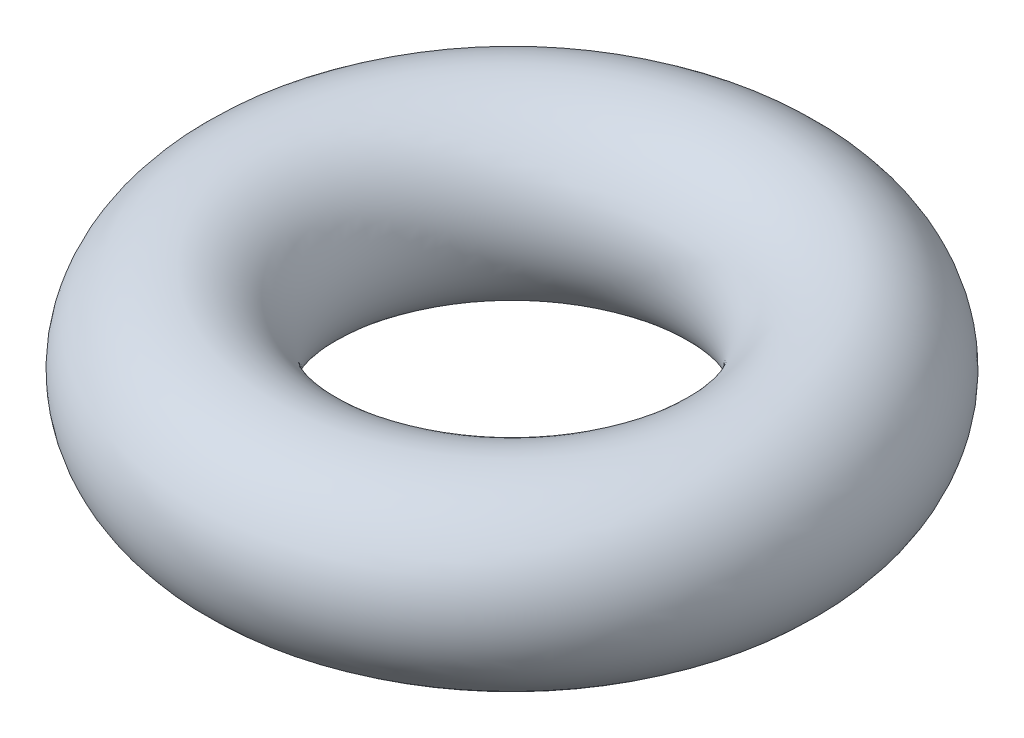
from build123d import *

# Parameters (mm, degrees)
SKETCH_1_R = 15


with BuildPart() as part:
    # 草图1 → 旋转1 (revolve)
    with BuildSketch(Plane.XY, mode=Mode.PRIVATE) as revolve_1_sk:
        with Locations((-40, 0)):
            Circle(SKETCH_1_R)
    revolve(revolve_1_sk.sketch.rotate(Axis((0, -27.111337062, 0), (0, 1, 0)), 180), axis=Axis((0, -27.111337062, 0), (0, 1, 0)))


solid = part.part
